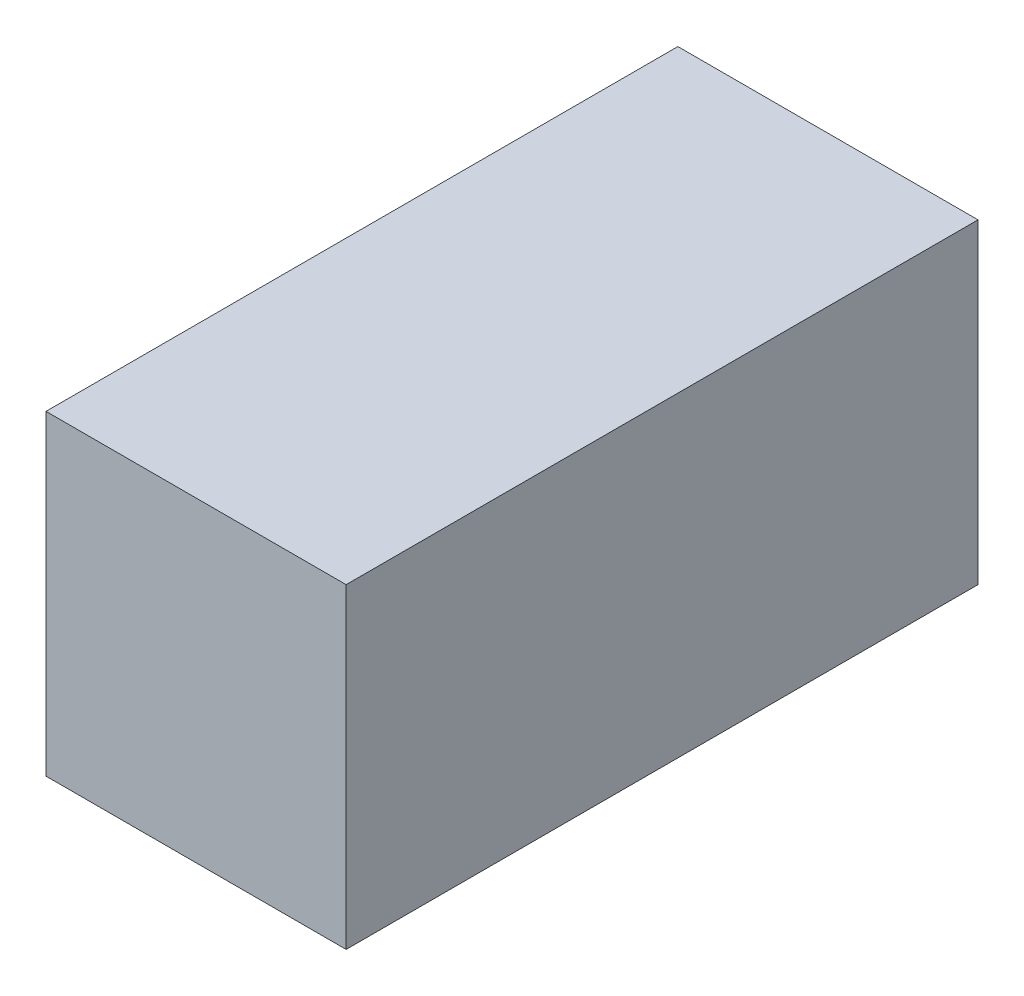
from build123d import *

# Parameters (mm, degrees)
SKETCH1_W           = 40
SKETCH1_H           = 20
BOSS_EXTRUDE1_DEPTH = 19


with BuildPart() as part:
    # Sketch1 → Boss-Extrude1 (new body)
    with BuildSketch(Plane(origin=(0, 0, 0), x_dir=(0, 0, -1), z_dir=(1, 0, 0))):
        with Locations((20, 10)):
            Rectangle(SKETCH1_W, SKETCH1_H)
    extrude(amount=BOSS_EXTRUDE1_DEPTH)


solid = part.part
